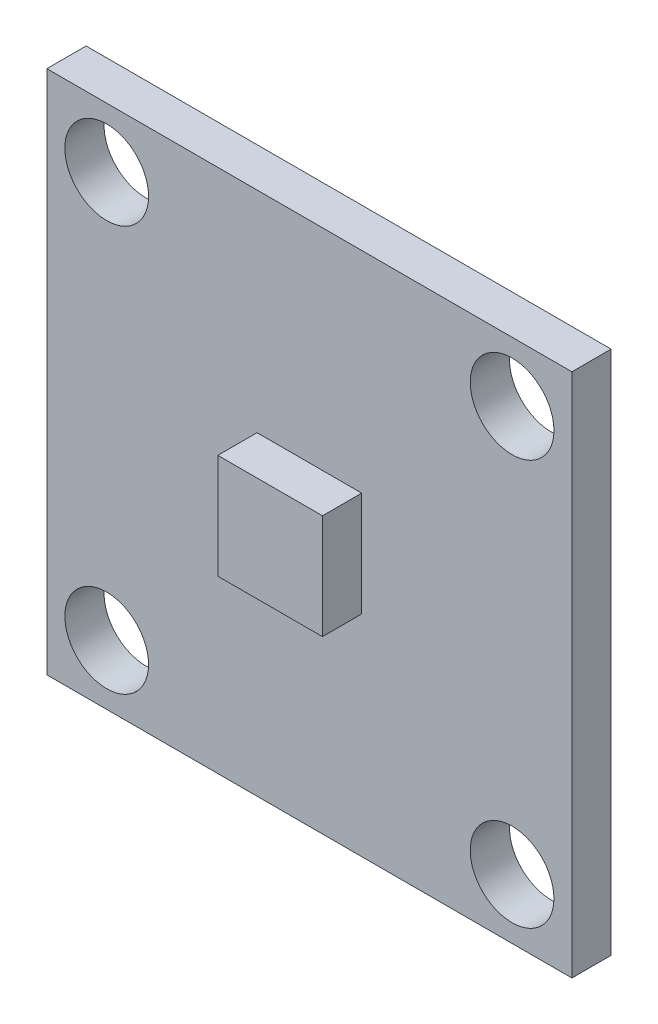
from build123d import *

# Parameters (mm, degrees)
SKETCH_1_W      = 20.066
SKETCH_1_H      = 20.066
SKETCH_1_R      = 1.6
EXTRUDE_1_DEPTH = 1.5
SKETCH_2_W      = 4
SKETCH_2_H      = 4
EXTRUDE_2_DEPTH = 1.5


with BuildPart() as part:
    # 草图1 → 凸台-拉伸1 (new body)
    with BuildSketch(Plane.XY):
        Rectangle(SKETCH_1_W, SKETCH_1_H)
        with Locations((-7.747, 7.747)):
            Circle(SKETCH_1_R, mode=Mode.SUBTRACT)
        with Locations((7.747, 7.747)):
            Circle(SKETCH_1_R, mode=Mode.SUBTRACT)
        with Locations((-7.747, -7.747)):
            Circle(SKETCH_1_R, mode=Mode.SUBTRACT)
        with Locations((7.747, -7.747)):
            Circle(SKETCH_1_R, mode=Mode.SUBTRACT)
    extrude(amount=EXTRUDE_1_DEPTH)

    # 草图2 → 凸台-拉伸2 (add)
    with BuildSketch(Plane.XY.offset(1.5)):
        Rectangle(SKETCH_2_W, SKETCH_2_H)
    extrude(amount=EXTRUDE_2_DEPTH)


solid = part.part
